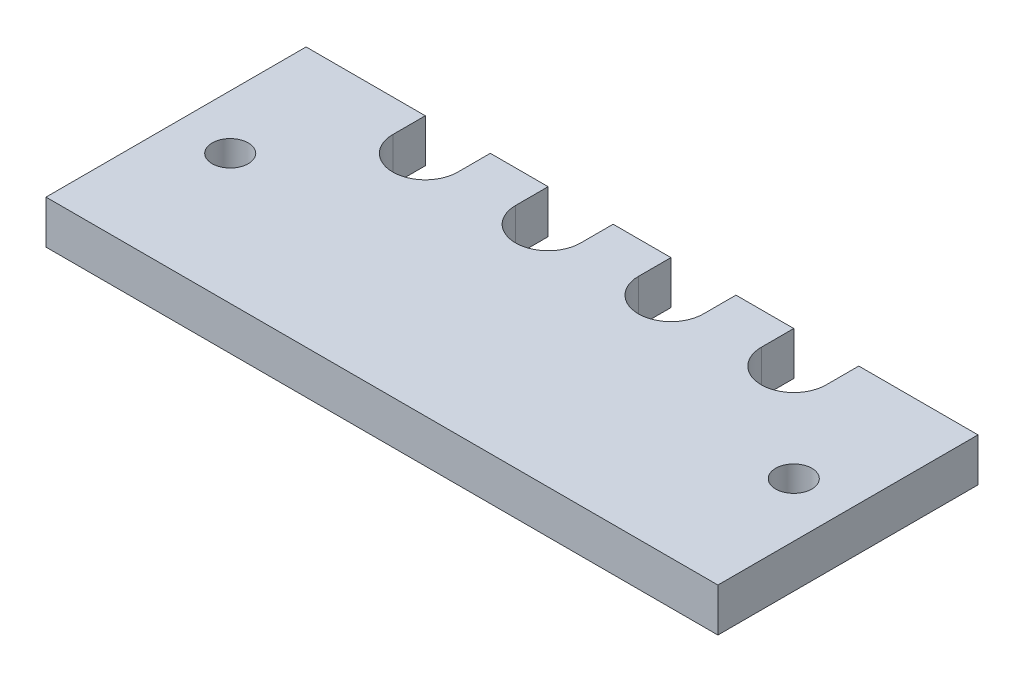
from build123d import *

# Parameters (mm, degrees)
SKETCH1_R           = 1.25
BOSS_EXTRUDE1_DEPTH = 3


with BuildPart() as part:
    # Sketch1 → Boss-Extrude1 (new body)
    with BuildSketch(Plane(origin=(0, 0, 0), x_dir=(1, 0, 0), z_dir=(0, 1, 0))):
        with BuildLine():
            Line((-23.25, 9), (-23.25, -9))
            Line((-23.25, -9), (23.25, -9))
            Line((23.25, -9), (23.25, 9))
            Line((23.25, 9), (15, 9))
            Line((15, 9), (15, 6.75))
            ThreePointArc((15, 6.75), (12.75, 4.5), (10.5, 6.75))
            Line((10.5, 6.75), (10.5, 9))
            Line((10.5, 9), (6.5, 9))
            Line((6.5, 9), (6.5, 6.75))
            ThreePointArc((6.5, 6.75), (4.25, 4.5), (2, 6.75))
            Line((2, 6.75), (2, 9))
            Line((2, 9), (-2, 9))
            Line((-2, 9), (-2, 6.75))
            ThreePointArc((-2, 6.75), (-4.25, 4.5), (-6.5, 6.75))
            Line((-6.5, 6.75), (-6.5, 9))
            Line((-6.5, 9), (-10.5, 9))
            Line((-10.5, 9), (-10.5, 6.75))
            ThreePointArc((-10.5, 6.75), (-12.75, 4.5), (-15, 6.75))
            Line((-15, 6.75), (-15, 9))
            Line((-15, 9), (-23.25, 9))
        make_face()
        with Locations(Location((-19.5, 0, 0), (0, 0, 270))):
            Circle(SKETCH1_R, mode=Mode.SUBTRACT)
        with Locations(Location((19.5, 0, 0), (0, 0, 270))):
            Circle(SKETCH1_R, mode=Mode.SUBTRACT)
    extrude(amount=BOSS_EXTRUDE1_DEPTH)


solid = part.part
